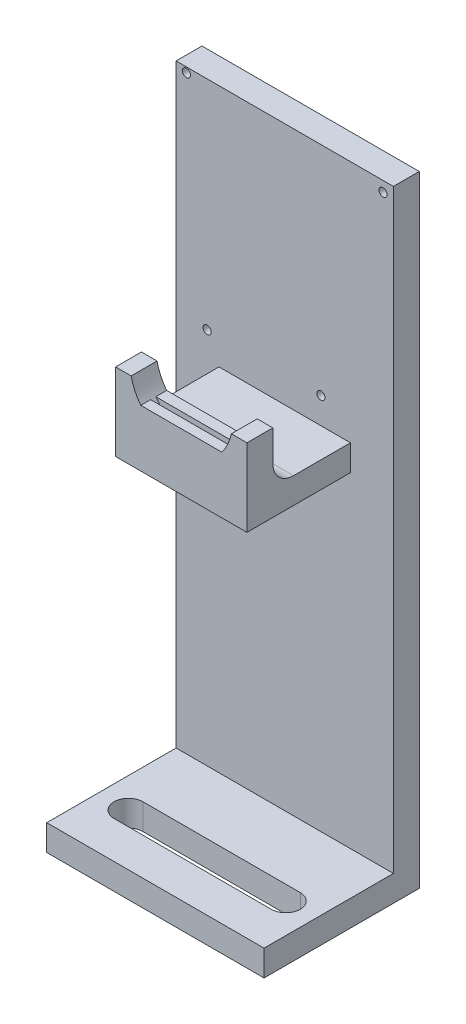
from build123d import *

# Parameters (mm, degrees)
SKETCH1_W           = 53.34
SKETCH1_H           = 152.4
SKETCH1_R           = 1
BOSS_EXTRUDE1_DEPTH = 6.35
SKETCH2_W           = 32.258
SKETCH2_H           = 6.35
BOSS_EXTRUDE2_DEPTH = 31.75
SKETCH3_W           = 32.258
SKETCH3_H           = 6.35
BOSS_EXTRUDE3_DEPTH = 12.7
CUT_EXTRUDE1_REACH  = 136.322
SKETCH4_R           = 12.573
SKETCH5_W           = 32.258
SKETCH5_H           = 2.671239047
SKETCH5_H_2         = 2.428760953
BOSS_EXTRUDE4_DEPTH = 7.62
FILLET1_R           = 5.08
SKETCH6_W           = 53.34
SKETCH6_H           = 6.35
BOSS_EXTRUDE5_DEPTH = 31.75
CUT_EXTRUDE3_REACH  = 159.154


with BuildPart() as part:
    # Sketch1 → Boss-Extrude1 (new body)
    with BuildSketch(Plane.XY):
        with Locations((-17.091445783, 46.760481928)):
            Rectangle(SKETCH1_W, SKETCH1_H)
        with Locations((-36.141445783, 69.620481928)):
            Circle(SKETCH1_R, mode=Mode.SUBTRACT)
        with Locations((-8.201445783, 69.620481928)):
            Circle(SKETCH1_R, mode=Mode.SUBTRACT)
        with Locations((-41.221445783, 121.690481928)):
            Circle(SKETCH1_R, mode=Mode.SUBTRACT)
        with Locations((7.038554217, 120.420481928)):
            Circle(SKETCH1_R, mode=Mode.SUBTRACT)
    extrude(amount=BOSS_EXTRUDE1_DEPTH)

    # Sketch2 → Boss-Extrude2 (add)
    with BuildSketch(Plane.XY):
        with Locations((-17.091445783, 60.014063864)):
            Rectangle(SKETCH2_W, SKETCH2_H)
    extrude(amount=BOSS_EXTRUDE2_DEPTH)

    # Sketch3 → Boss-Extrude3 (add)
    with BuildSketch(Plane(origin=(0, 63.189063864, 0), x_dir=(1, 0, 0), z_dir=(0, 1, 0))):
        with Locations((-17.091445783, -28.575)):
            Rectangle(SKETCH3_W, SKETCH3_H)
    extrude(amount=BOSS_EXTRUDE3_DEPTH)

    # Sketch4 → Cut-Extrude1 (cut, up to next)
    with BuildSketch(Plane.XY.offset(31.75), mode=Mode.PRIVATE) as cut_extrude1_sk1:
        with Locations((-17.091445783, 78.510481928)):
            Circle(SKETCH4_R)
    cut_extrude1_tool1 = extrude(cut_extrude1_sk1.sketch, amount=-CUT_EXTRUDE1_REACH, mode=Mode.PRIVATE) & part.part
    add(cut_extrude1_tool1.solids().sort_by_distance((-17.091446, 78.510482, 31.75))[0], mode=Mode.SUBTRACT)

    # Sketch5 → Boss-Extrude4 (add)
    with BuildSketch(Plane(origin=(0, 63.189063864, 0), x_dir=(1, 0, 0), z_dir=(0, 1, 0))):
        with Locations((-17.091445783, -26.735619524)):
            Rectangle(SKETCH5_W, SKETCH5_H)
        with Locations((-17.091445783, -30.535619524)):
            Rectangle(SKETCH5_W, SKETCH5_H_2)
    extrude(amount=BOSS_EXTRUDE4_DEPTH)

    # Fillet1
    fillet1_edges = [part.edges().sort_by_distance(p)[0] for p in [
        (-17.091445783, 63.189063864, 25.4),
    ]]
    fillet(fillet1_edges, radius=FILLET1_R)

    # Sketch6 → Boss-Extrude5 (add)
    with BuildSketch(Plane.XY.offset(6.35)):
        with Locations((-17.091445783, -26.264518072)):
            Rectangle(SKETCH6_W, SKETCH6_H)
    extrude(amount=BOSS_EXTRUDE5_DEPTH)

    # Sketch7 → Cut-Extrude3 (cut, up to next)
    with BuildSketch(Plane(origin=(0, -23.089518072, 0), x_dir=(1, 0, 0), z_dir=(0, 1, 0)), mode=Mode.PRIVATE) as cut_extrude3_sk1:
        with BuildLine():
            Line((-36.395445783, -21.844), (2.212554217, -21.844))
            ThreePointArc((2.212554217, -21.844), (5.768554217, -25.4), (2.212554217, -28.956))
            Line((2.212554217, -28.956), (-36.395445783, -28.956))
            ThreePointArc((-36.395445783, -28.956), (-39.951445783, -25.4), (-36.395445783, -21.844))
        make_face()
    cut_extrude3_tool1 = extrude(cut_extrude3_sk1.sketch, amount=-CUT_EXTRUDE3_REACH, mode=Mode.PRIVATE) & part.part
    add(cut_extrude3_tool1.solids().sort_by_distance((-17.091446, -23.089518, 25.4))[0], mode=Mode.SUBTRACT)


solid = part.part
